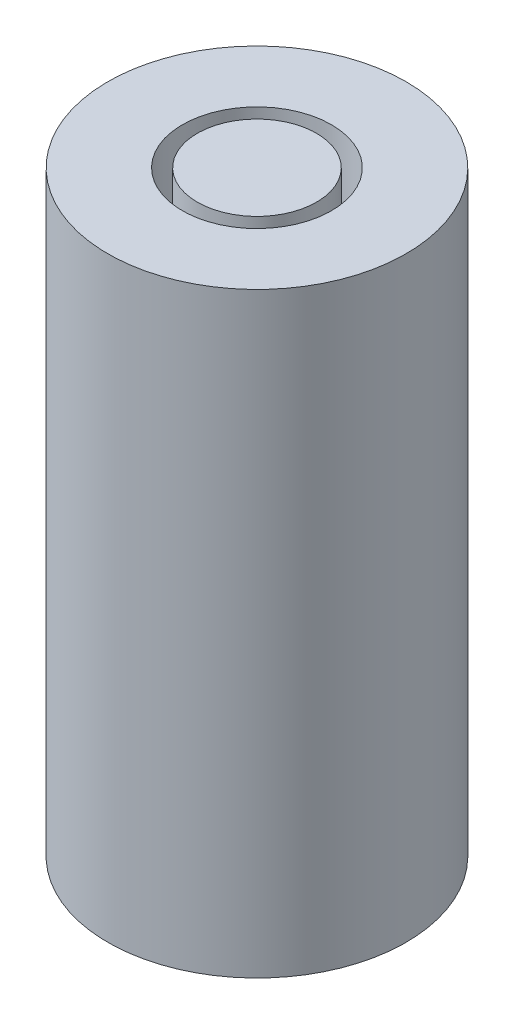
from build123d import *

# Parameters (mm, degrees)
SKETCH1_R           = 1
BOSS_EXTRUDE1_DEPTH = 10
SKETCH2_R           = 2.5
SKETCH2_R_2         = 1.25
BOSS_EXTRUDE2_DEPTH = 10


with BuildPart() as part:
    # Sketch1 → Boss-Extrude1 (new body)
    with BuildSketch(Plane(origin=(0, 0, 0), x_dir=(1, 0, 0), z_dir=(0, 1, 0))):
        with Locations(Location((0, 0, 0), (0, 0, 270))):
            Circle(SKETCH1_R)
    extrude(amount=BOSS_EXTRUDE1_DEPTH)


with BuildPart() as body_2:
    # Sketch2 → Boss-Extrude2 (new body)
    with BuildSketch(Plane.XZ):
        with Locations(Location((0, 0, 0), (0, 0, 270))):
            Circle(SKETCH2_R)
        with Locations(Location((0, 0, 0), (0, 0, 270))):
            Circle(SKETCH2_R_2, mode=Mode.SUBTRACT)
    extrude(amount=-BOSS_EXTRUDE2_DEPTH)


solid = Compound([part.part, body_2.part])
